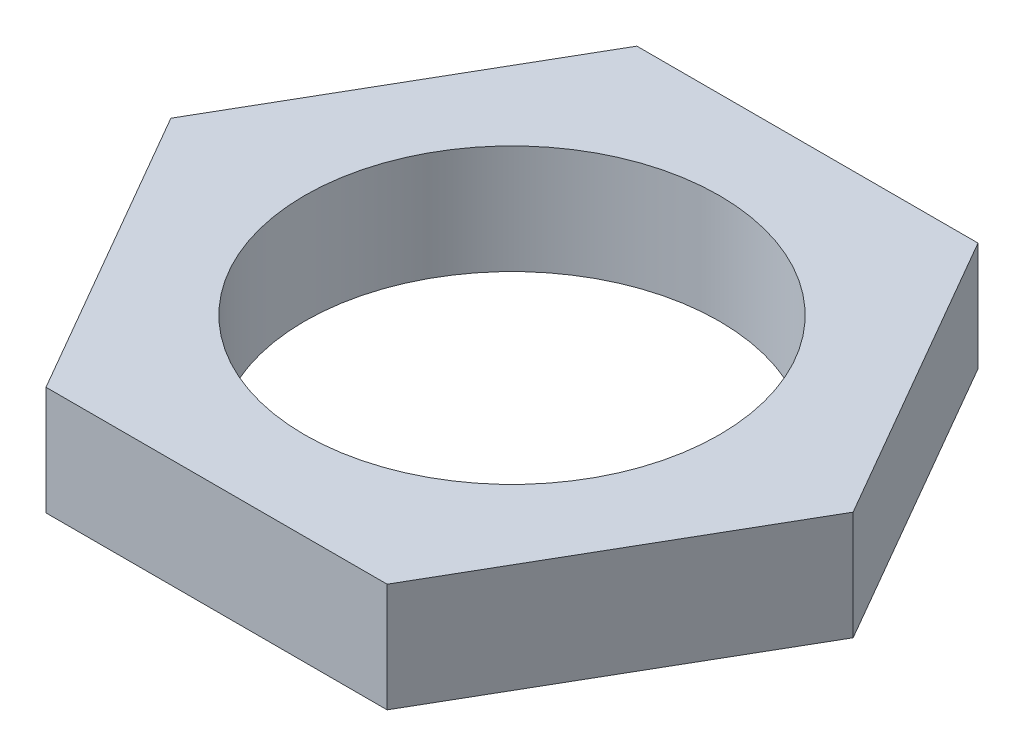
from build123d import *

# Parameters (mm, degrees)
SKETCH1_R           = 4.4
BOSS_EXTRUDE1_DEPTH = 2.31


with BuildPart() as part:
    # Sketch1 → Boss-Extrude1 (new body)
    with BuildSketch(Plane(origin=(0, 0, 0), x_dir=(1, 0, 0), z_dir=(0, 1, 0))):
        Polygon((-3.619986188, -6.27), (3.619986188, -6.27), (7.239972376, 0), (3.619986188, 6.27), (-3.619986188, 6.27), (-7.239972376, 0), align=None)
        with Locations(Location((0, 0, 0), (0, 0, 270))):
            Circle(SKETCH1_R, mode=Mode.SUBTRACT)
    extrude(amount=BOSS_EXTRUDE1_DEPTH)


solid = part.part
